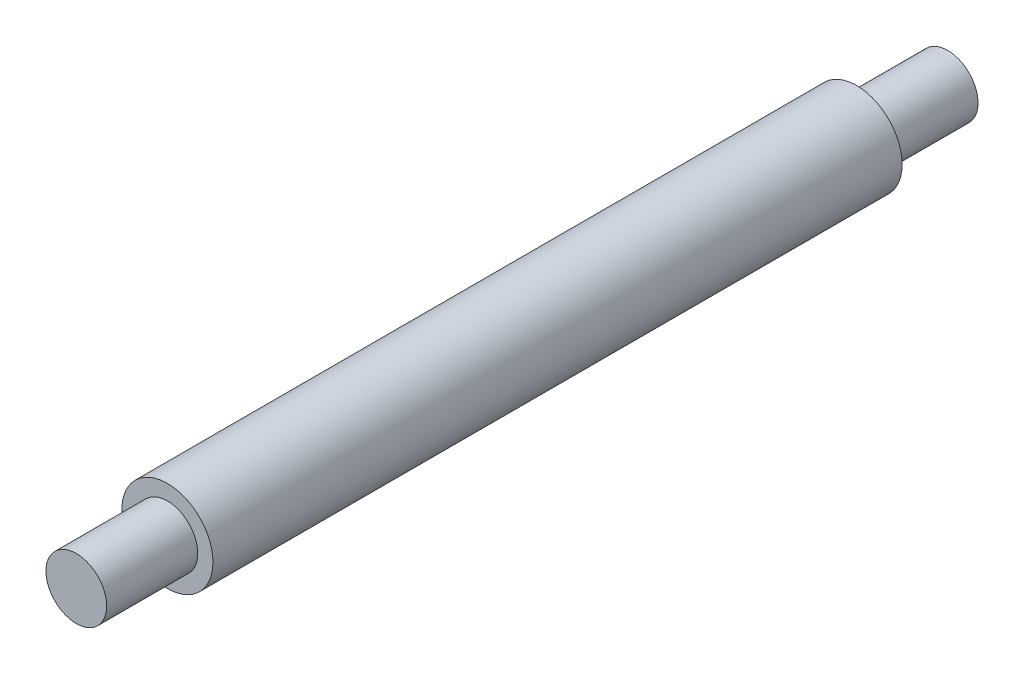
from build123d import *

# Parameters (mm, degrees)
SKETCH_1_R      = 1.5
EXTRUDE_1_DEPTH = 22.7
SKETCH_2_R      = 1
EXTRUDE_2_DEPTH = 3
EXTRUDE_START   = 3
SKETCH_3_R      = 1
EXTRUDE_3_DEPTH = 3


with BuildPart() as part:
    # 草图1 → 凸台-拉伸1 (new body)
    with BuildSketch(Plane.XY):
        Circle(SKETCH_1_R)
    extrude(amount=EXTRUDE_1_DEPTH)

    # 草图2 → 凸台-拉伸2 (add)
    with BuildSketch(Plane(origin=(0, 0, 0), x_dir=(-1, 0, 0), z_dir=(0, 0, -1))):
        Circle(SKETCH_2_R)
    extrude(amount=EXTRUDE_2_DEPTH)

    # 草图3 → 凸台-拉伸3 (add)
    with BuildSketch(Plane.XY.offset(22.7).offset(EXTRUDE_START)):
        with Locations(Location((0, 0, 0), (0, 0, 180))):
            Circle(SKETCH_3_R)
    extrude(amount=-EXTRUDE_3_DEPTH)


solid = part.part
